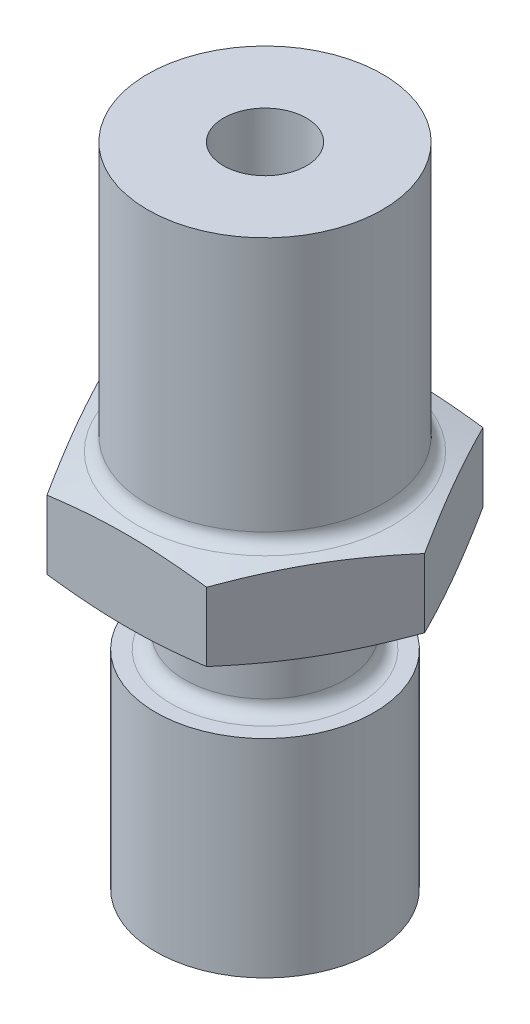
from build123d import *

# Parameters (mm, degrees)
SKETCH1_R           = 4.25
BOSS_EXTRUDE1_DEPTH = 9.6
BOSS_EXTRUDE2_DEPTH = 3.3
SKETCH3_OUTSIDE_W   = 42.178
SKETCH3_OUTSIDE_H   = 40.63
SKETCH3_OUTSIDE_R   = 4.25
CUT_EXTRUDE4_DEPTH  = 3.3
CUT_EXTRUDE4_DRAFT  = -75
SKETCH5_OUTSIDE_W   = 42.178
SKETCH5_OUTSIDE_H   = 40.63
SKETCH5_OUTSIDE_R   = 4.25
CUT_EXTRUDE5_DEPTH  = 3.3
CUT_EXTRUDE5_DRAFT  = -75
SKETCH6_R           = 2.9
BOSS_EXTRUDE3_DEPTH = 3
SKETCH7_R           = 3.95
BOSS_EXTRUDE4_DEPTH = 7.5
SKETCH8_R           = 1.5
CUT_EXTRUDE6_DEPTH  = 25.614900636
SKETCH9_R           = 2.25
CUT_EXTRUDE7_DEPTH  = 10
FILLET1_R           = 0.5
SKETCH10_R          = 1.5
CUT_EXTRUDE8_DEPTH  = 16.772550063
CHAMFER1_SIZE       = 1


with BuildPart() as part:
    # Sketch1 → Boss-Extrude1 (new body)
    with BuildSketch(Plane(origin=(0, 0, 0), x_dir=(1, 0, 0), z_dir=(0, 1, 0))):
        with Locations(Location((0, 0, 0), (0, 0, 270))):
            Circle(SKETCH1_R)
    extrude(amount=BOSS_EXTRUDE1_DEPTH)

    # Sketch2 → Boss-Extrude2 (add)
    with BuildSketch(Plane.XZ):
        Polygon((-2.886751346, 5), (-5.773502692, 0), (-2.886751346, -5), (2.886751346, -5), (5.773502692, 0), (2.886751346, 5), align=None)
    extrude(amount=BOSS_EXTRUDE2_DEPTH)


with BuildPart() as cut_extrude4_tool:
    # Sketch3 outside → Cut-Extrude4 (with draft: the straight prism first)
    with BuildSketch(Plane.XZ.offset(3.3)):
        Rectangle(SKETCH3_OUTSIDE_W, SKETCH3_OUTSIDE_H)
        with Locations(Location((0, 0, 0), (0, 0, 90))):
            Circle(SKETCH3_OUTSIDE_R, mode=Mode.SUBTRACT)
    extrude(amount=-CUT_EXTRUDE4_DEPTH)
    # Cut-Extrude4: the draft: its side faces are tilted about the plane it starts from
    cut_extrude4_sides = [cut_extrude4_tool.faces().sort_by_distance(p)[0] for p in [
        (0, -1.65, -20.315),
        (21.089, -1.65, 0),
        (0, -1.65, 20.315),
        (-21.089, -1.65, 0),
        (0, -1.65, -4.25),
    ]]
    draft(cut_extrude4_sides, Plane.XZ.offset(3.3), CUT_EXTRUDE4_DRAFT)


with BuildPart() as part_1:
    add(part.part)

    # Cut-Extrude4: cut by cut_extrude4_tool
    add(cut_extrude4_tool.part, mode=Mode.SUBTRACT)


with BuildPart() as cut_extrude5_tool:
    # Sketch5 outside → Cut-Extrude5 (with draft: the straight prism first)
    with BuildSketch(Plane(origin=(0, 0, 0), x_dir=(1, 0, 0), z_dir=(0, 1, 0))):
        Rectangle(SKETCH5_OUTSIDE_W, SKETCH5_OUTSIDE_H)
        with Locations(Location((0, 0, 0), (0, 0, 270))):
            Circle(SKETCH5_OUTSIDE_R, mode=Mode.SUBTRACT)
    extrude(amount=-CUT_EXTRUDE5_DEPTH)
    # Cut-Extrude5: the draft: its side faces are tilted about the plane it starts from
    cut_extrude5_sides = [cut_extrude5_tool.faces().sort_by_distance(p)[0] for p in [
        (0, -1.65, 20.315),
        (21.089, -1.65, 0),
        (0, -1.65, -20.315),
        (-21.089, -1.65, 0),
        (0, -1.65, -4.25),
    ]]
    draft(cut_extrude5_sides, Plane(origin=(0, 0, 0), x_dir=(1, 0, 0), z_dir=(0, 1, 0)), CUT_EXTRUDE5_DRAFT)


with BuildPart() as part_2:
    add(part_1.part)

    # Cut-Extrude5: cut by cut_extrude5_tool
    add(cut_extrude5_tool.part, mode=Mode.SUBTRACT)

    # Sketch6 → Boss-Extrude3 (add)
    with BuildSketch(Plane.XZ.offset(3.3)):
        with Locations(Location((0, 0, 0), (0, 0, 270))):
            Circle(SKETCH6_R)
    extrude(amount=BOSS_EXTRUDE3_DEPTH)

    # Sketch7 → Boss-Extrude4 (add)
    with BuildSketch(Plane.XZ.offset(6.3)):
        with Locations(Location((0, 0, 0), (0, 0, 270))):
            Circle(SKETCH7_R)
    extrude(amount=BOSS_EXTRUDE4_DEPTH)

    # Sketch8 → Cut-Extrude6 (cut, through all)
    with BuildSketch(Plane.XZ.offset(13.8)):
        with Locations(Location((0, 0, 0), (0, 0, 270))):
            Circle(SKETCH8_R)
    extrude(amount=-CUT_EXTRUDE6_DEPTH, mode=Mode.SUBTRACT)

    # Sketch9 → Cut-Extrude7 (cut)
    with BuildSketch(Plane.XZ.offset(13.8)):
        with Locations(Location((0, 0, 0), (0, 0, 270))):
            Circle(SKETCH9_R)
    extrude(amount=-CUT_EXTRUDE7_DEPTH, mode=Mode.SUBTRACT)

    # Fillet1
    fillet1_edges = [part_2.edges().sort_by_distance(p)[0] for p in [
        (0, 0, -4.25),
        (0, -3.3, 2.9),
        (0, -6.3, 2.9),
    ]]
    fillet(fillet1_edges, radius=FILLET1_R)

    # Sketch10 → Cut-Extrude8 (cut, through all)
    with BuildSketch(Plane.XY):
        with Locations(Location((0, 5.6, 0), (0, 0, 90))):
            Circle(SKETCH10_R)
    extrude(amount=-CUT_EXTRUDE8_DEPTH, mode=Mode.SUBTRACT)

    # Chamfer1
    chamfer1_edges = [part_2.edges().sort_by_distance(p)[0] for p in [
        (0, -13.8, 2.25),
    ]]
    chamfer(chamfer1_edges, length=CHAMFER1_SIZE)


solid = part_2.part
